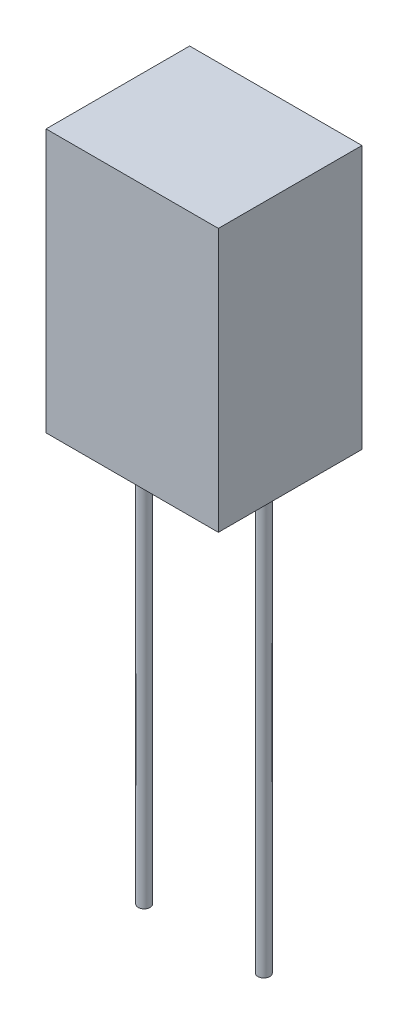
from build123d import *

# Parameters (mm, degrees)
SKETCH1_W           = 7.2
SKETCH1_H           = 11
BOSS_EXTRUDE1_DEPTH = 6
SKETCH2_R           = 0.25
BOSS_EXTRUDE2_DEPTH = 18


with BuildPart() as part:
    # Sketch1 → Boss-Extrude1 (new body)
    with BuildSketch(Plane.XY):
        Rectangle(SKETCH1_W, SKETCH1_H)
    extrude(amount=BOSS_EXTRUDE1_DEPTH)

    # Sketch2 → Boss-Extrude2 (add)
    with BuildSketch(Plane.XZ.offset(5.5)):
        with Locations(Location((-2.5, 3, 0), (0, 0, 90))):
            Circle(SKETCH2_R)
        with Locations(Location((2.5, 3, 0), (0, 0, 90))):
            Circle(SKETCH2_R)
    extrude(amount=BOSS_EXTRUDE2_DEPTH)


solid = part.part
